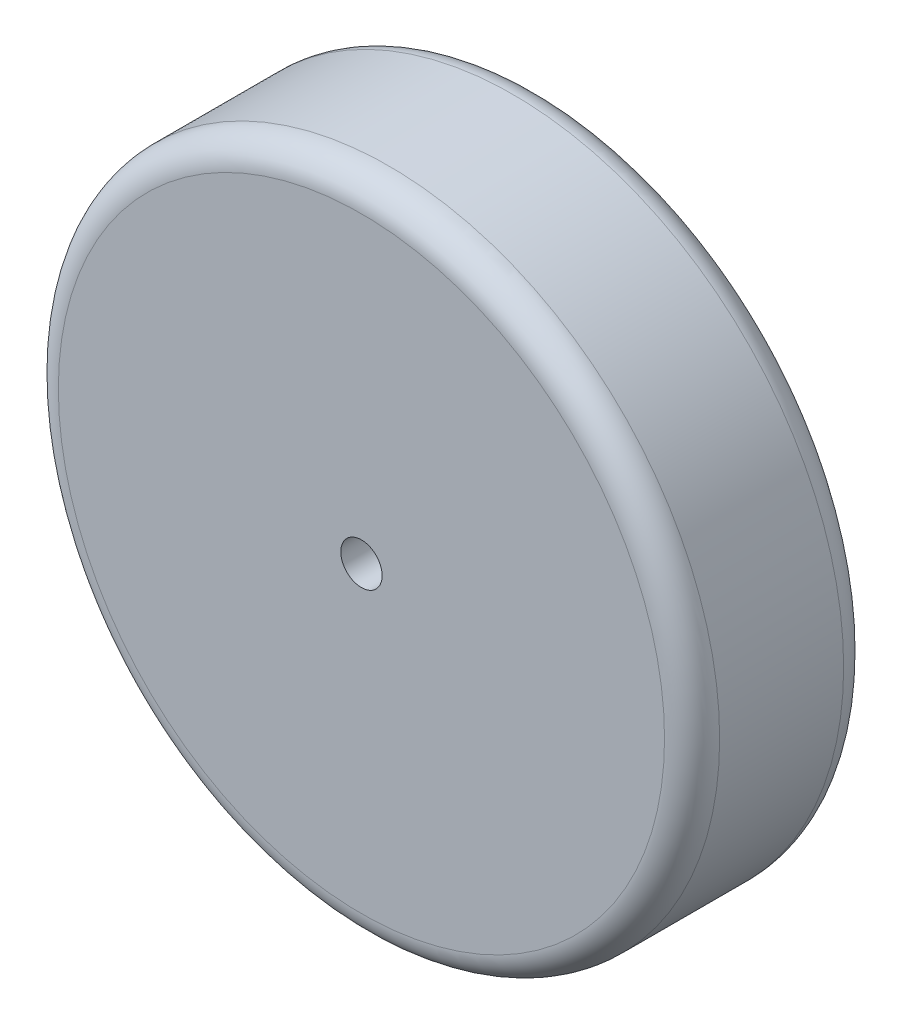
from build123d import *

# Parameters (mm, degrees)
CROQUIS1_R              = 24
CROQUIS1_R_2            = 1.5
SALIENTE_EXTRUIR1_DEPTH = 13
REDONDEO1_R             = 2
REDONDEO2_R             = 2


with BuildPart() as part:
    # Croquis1 → Saliente-Extruir1 (new body)
    with BuildSketch(Plane.XY):
        with Locations(Location((-49.242561536, 14.193667069, 0), (0, 0, 180))):
            Circle(CROQUIS1_R)
        with Locations(Location((-49.242561536, 14.193667069, 0), (0, 0, 180))):
            Circle(CROQUIS1_R_2, mode=Mode.SUBTRACT)
    extrude(amount=SALIENTE_EXTRUIR1_DEPTH)

    # Redondeo1
    redondeo1_edges = [part.edges().sort_by_distance(p)[0] for p in [
        (-25.242561536, 14.193667069, 13),
    ]]
    fillet(redondeo1_edges, radius=REDONDEO1_R)

    # Redondeo2
    redondeo2_edges = [part.edges().sort_by_distance(p)[0] for p in [
        (-25.242561536, 14.193667069, 0),
    ]]
    fillet(redondeo2_edges, radius=REDONDEO2_R)


solid = part.part
